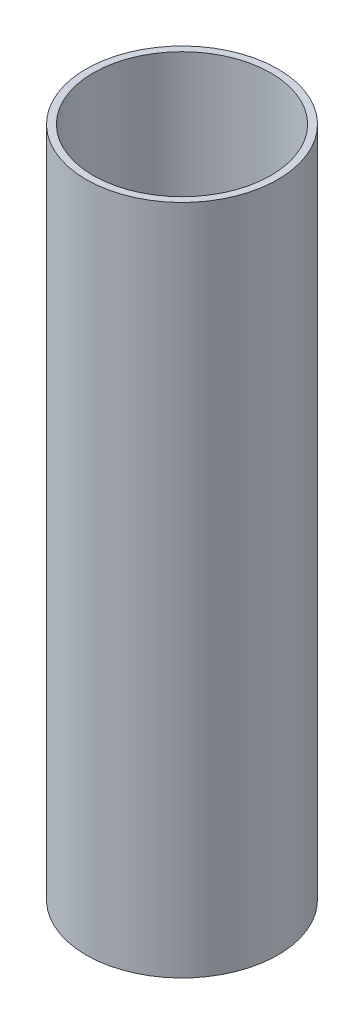
from build123d import *

# Parameters (mm, degrees)
SKETCH1_R           = 25.35
SKETCH1_R_2         = 23.5
BOSS_EXTRUDE1_DEPTH = 177.66


with BuildPart() as part:
    # Sketch1 → Boss-Extrude1 (new body)
    with BuildSketch(Plane(origin=(0, 0, 0), x_dir=(1, 0, 0), z_dir=(0, 1, 0))):
        with Locations(Location((0, 0, 0), (0, 0, 270))):
            Circle(SKETCH1_R)
        with Locations(Location((0, 0, 0), (0, 0, 270))):
            Circle(SKETCH1_R_2, mode=Mode.SUBTRACT)
    extrude(amount=BOSS_EXTRUDE1_DEPTH)


solid = part.part
